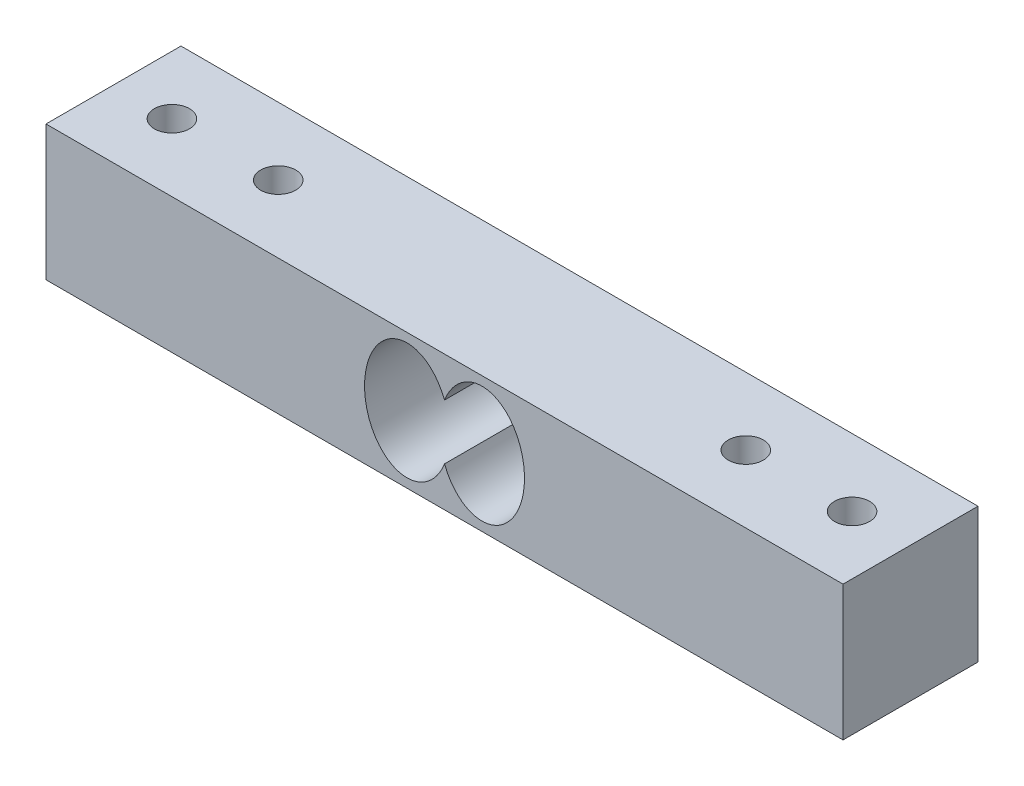
from build123d import *

# Parameters (mm, degrees)
SKETCH1_W               = 75
SKETCH1_H               = 12.7
SKETCH1_R               = 1.65
BOSS_EXTRUDE1_DEPTH     = 6.35
CUT_EXTRUDE1_DEPTH      = 39.560277489
CUT_EXTRUDE1_DEPTH_BACK = 39.560277489


with BuildPart() as part:
    # Sketch1 → Boss-Extrude1 (new, symmetric)
    with BuildSketch(Plane(origin=(0, 0, 0), x_dir=(1, 0, 0), z_dir=(0, 1, 0))):
        Rectangle(SKETCH1_W, SKETCH1_H)
        with Locations(Location((-32, 0, 0), (0, 0, 270))):
            Circle(SKETCH1_R, mode=Mode.SUBTRACT)
        with Locations(Location((-22, 0, 0), (0, 0, 270))):
            Circle(SKETCH1_R, mode=Mode.SUBTRACT)
        with Locations(Location((22, 0, 0), (0, 0, 270))):
            Circle(SKETCH1_R, mode=Mode.SUBTRACT)
        with Locations(Location((32, 0, 0), (0, 0, 270))):
            Circle(SKETCH1_R, mode=Mode.SUBTRACT)
    extrude(amount=BOSS_EXTRUDE1_DEPTH, both=True)

    # Sketch2 → Cut-Extrude1 (cut, two sides: drawn at the far end of the back side and taken through both)
    with BuildSketch(Plane.XY.offset(-CUT_EXTRUDE1_DEPTH_BACK)):
        with BuildLine():
            add(Edge.make_bspline(
                [(0, 2.6), (-2.301717076, 8.499603143), (-6.063963556, 4.249801571), (-9.826210036, 0), (-6.063963556, -4.249801571), (-2.301717076, -8.499603143), (0, -2.6)],
                knots=[2.063179467, 2.063179467, 2.063179467, 3.829319143, 3.829319143, 5.595458818, 5.595458818, 7.361598494, 7.361598494, 7.361598494], degree=2, weights=[1, 0.634782102, 1, 0.634782102, 1, 0.634782102, 1]))
            add(Edge.make_bspline(
                [(0, -2.6), (2.301717076, -8.499603143), (6.063963556, -4.249801571), (9.826210036, 0), (6.063963556, 4.249801571), (2.301717076, 8.499603143), (0, 2.6)],
                knots=[2.063179467, 2.063179467, 2.063179467, 3.829319143, 3.829319143, 5.595458818, 5.595458818, 7.361598494, 7.361598494, 7.361598494], degree=2, weights=[1, 0.634782102, 1, 0.634782102, 1, 0.634782102, 1]))
        make_face()
    extrude(amount=CUT_EXTRUDE1_DEPTH + CUT_EXTRUDE1_DEPTH_BACK, mode=Mode.SUBTRACT)


solid = part.part
